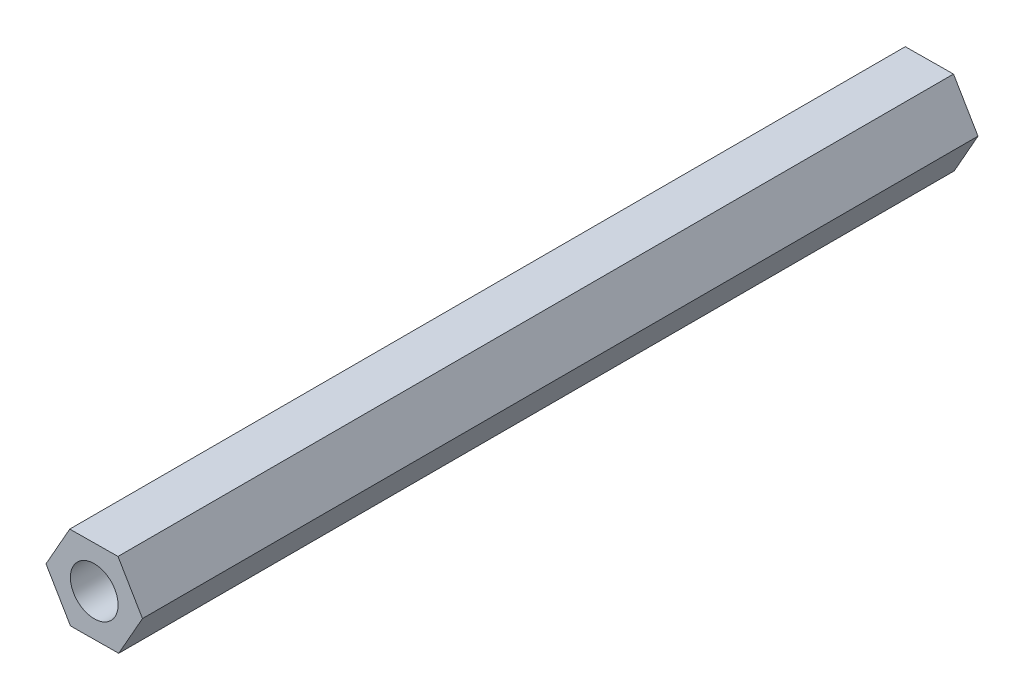
from build123d import *

# Parameters (mm, degrees)
SKETCH_1_R      = 2
EXTRUDE_1_DEPTH = 70


with BuildPart() as part:
    # 草图1 → 凸台-拉伸1 (new body)
    with BuildSketch(Plane.XY):
        Polygon((2.051456248, -3.482077052), (4.041295309, 0.035574699), (1.989839061, 3.517651751), (-2.051456248, 3.482077052), (-4.041295309, -0.035574699), (-1.989839061, -3.517651751), align=None)
        Circle(SKETCH_1_R, mode=Mode.SUBTRACT)
    extrude(amount=EXTRUDE_1_DEPTH)


solid = part.part
